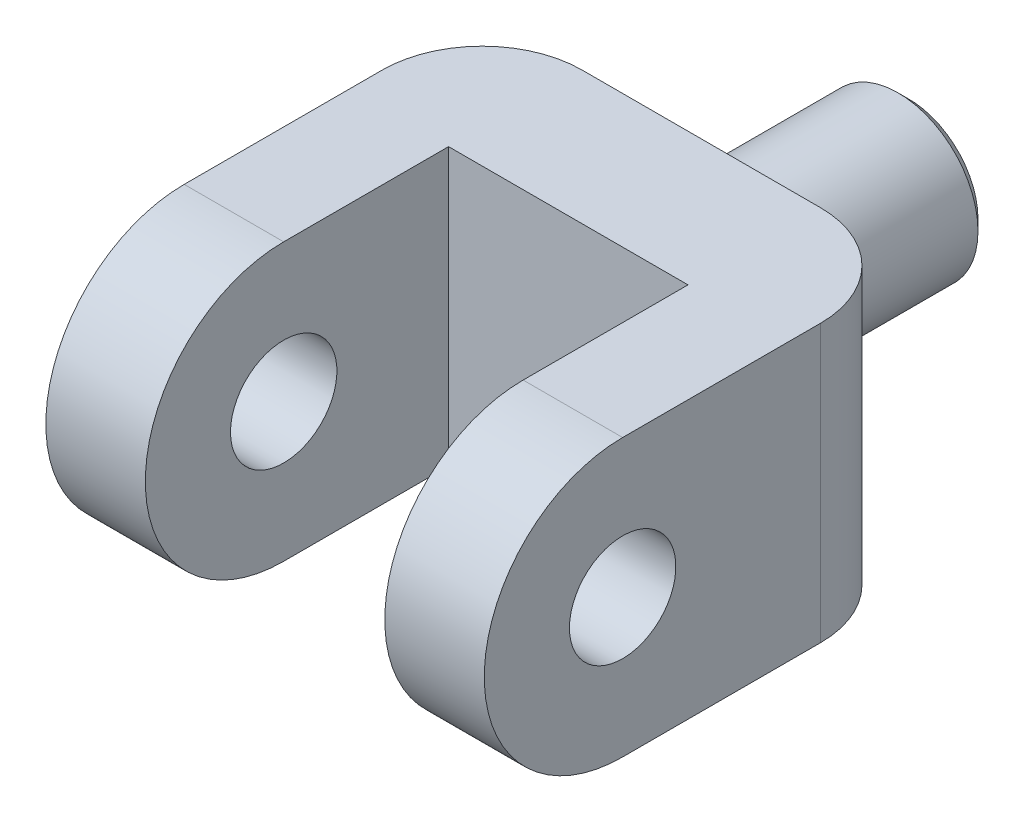
from build123d import *

# Parameters (mm, degrees)
SALIENTE_EXTRUIR2_DEPTH = 2.6
REDONDEO1_RADIUS        = 1.3
REDONDEO1_LENGTH        = 0.935
REDONDEO2_RADIUS        = 1.3
REDONDEO2_LENGTH        = 0.935
CROQUIS2_R              = 0.5
CORTAR_EXTRUIR1_DEPTH   = 6.812051501
REDONDEO4_R             = 0.94
CROQUIS3_R              = 0.75
SALIENTE_EXTRUIR3_DEPTH = 3.2
CHAFL_N1_SIZE           = 0.1


with BuildPart() as part:
    # Croquis1 → Saliente-Extruir2 (new body)
    with BuildSketch(Plane(origin=(0, 0, 0), x_dir=(1, 0, 0), z_dir=(0, 1, 0))):
        Polygon((-2.223605772, 3.169470405), (1.896394228, 3.169470405), (1.896394228, -0.930529595), (0.961394228, -0.930529595), (0.961394228, 1.918816199), (-1.288605772, 1.918816199), (-1.288605772, -0.930529595), (-2.223605772, -0.930529595), align=None)
    extrude(amount=SALIENTE_EXTRUIR2_DEPTH)

    # Redondeo1: full round fillet: the end face becomes a half cylinder, R = half its width
    redondeo1_face = Plane((1.428894228, 1.3, 0.930529595), x_dir=(-1, 0, 0), z_dir=(0, 0, 1))  # on the end face: x along it, z out of the body
    redondeo1_slab = redondeo1_face.offset(-REDONDEO1_RADIUS / 2) * Box(REDONDEO1_LENGTH, 2 * REDONDEO1_RADIUS, REDONDEO1_RADIUS, mode=Mode.PRIVATE)  # the body's end, R deep
    redondeo1_round = Plane((1.428894228, 1.3, -0.369470405), x_dir=(0, 0, 1), z_dir=(-1, 0, 0)) * Cylinder(REDONDEO1_RADIUS, REDONDEO1_LENGTH, mode=Mode.PRIVATE)  # its axis R under the face
    add(redondeo1_slab - redondeo1_round, mode=Mode.SUBTRACT)

    # Redondeo2: full round fillet: the end face becomes a half cylinder, R = half its width
    redondeo2_face = Plane((-1.756105772, 1.3, 0.930529595), x_dir=(1, 0, 0), z_dir=(0, 0, 1))  # on the end face: x along it, z out of the body
    redondeo2_slab = redondeo2_face.offset(-REDONDEO2_RADIUS / 2) * Box(REDONDEO2_LENGTH, 2 * REDONDEO2_RADIUS, REDONDEO2_RADIUS, mode=Mode.PRIVATE)  # the body's end, R deep
    redondeo2_round = Plane((-1.756105772, 1.3, -0.369470405), x_dir=(0, 0, 1), z_dir=(1, 0, 0)) * Cylinder(REDONDEO2_RADIUS, REDONDEO2_LENGTH, mode=Mode.PRIVATE)  # its axis R under the face
    add(redondeo2_slab - redondeo2_round, mode=Mode.SUBTRACT)

    # Croquis2 → Cortar-Extruir1 (cut, through all)
    with BuildSketch(Plane.ZY.offset(2.223605772)):
        with Locations((-0.369470405, 1.3)):
            Circle(CROQUIS2_R)
    extrude(amount=-CORTAR_EXTRUIR1_DEPTH, mode=Mode.SUBTRACT)

    # Redondeo4
    redondeo4_edges = [part.edges().sort_by_distance(p)[0] for p in [
        (-2.223605772, 1.3, -3.169470405),
        (1.896394228, 1.3, -3.169470405),
    ]]
    fillet(redondeo4_edges, radius=REDONDEO4_R)

    # Croquis3 → Saliente-Extruir3 (add)
    with BuildSketch(Plane.XY.offset(-1.918816199)):
        with Locations((-0.163605772, 1.3)):
            Circle(CROQUIS3_R)
    extrude(amount=-SALIENTE_EXTRUIR3_DEPTH)

    # Chaflán1
    chafl_n1_edges = [part.edges().sort_by_distance(p)[0] for p in [
        (-0.913605772, 1.3, -5.118816199),
    ]]
    chamfer(chafl_n1_edges, length=CHAFL_N1_SIZE)


solid = part.part
